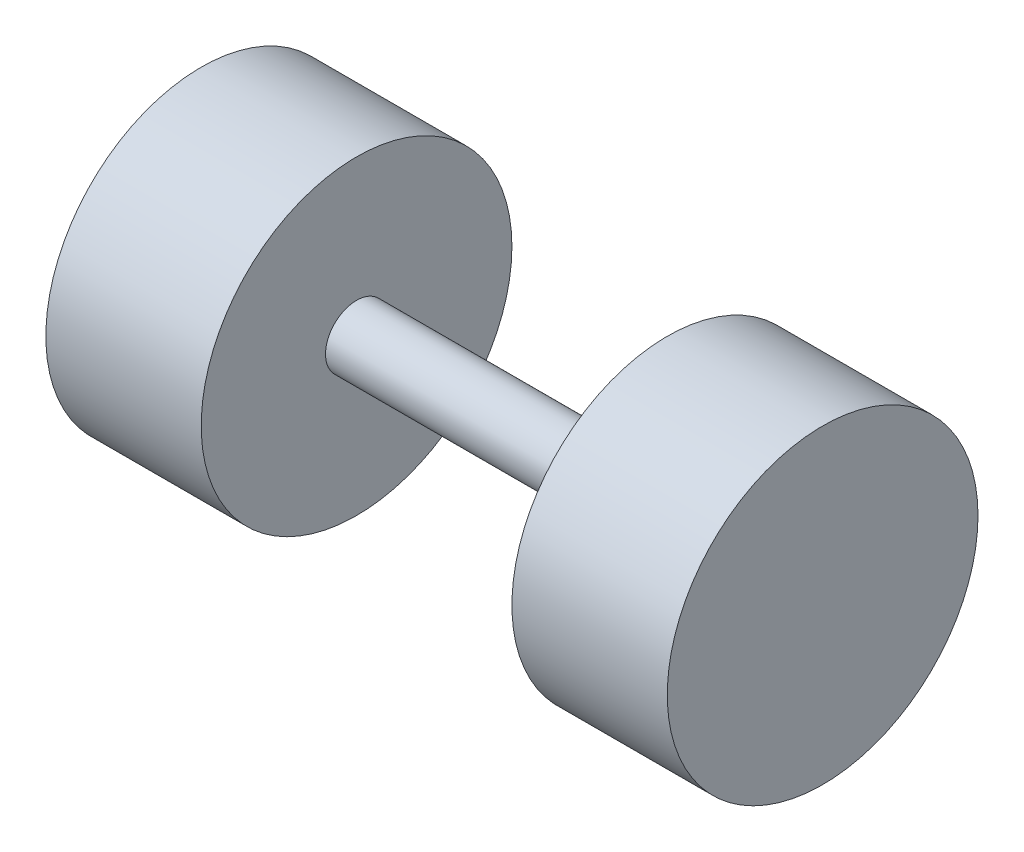
from build123d import *

# Parameters (mm, degrees)
SKETCH_1_W   = 500
SKETCH_1_H   = 100
SKETCH_1_H_2 = 500


with BuildPart() as part:
    # ｽｹｯﾁ1 → 回転1 (revolve)
    with BuildSketch(Plane.XY, mode=Mode.PRIVATE) as revolve_1_sk:
        with Locations((-250, -50)):
            Rectangle(SKETCH_1_W, SKETCH_1_H)
        with Locations((250, -250)):
            Rectangle(SKETCH_1_W, SKETCH_1_H_2)
    revolve(revolve_1_sk.sketch.rotate(Axis((0, 0, 0), (-1, 0, 0)), 270), axis=Axis((0, 0, 0), (-1, 0, 0)))

    # ﾐﾗｰ1: part across plane


with BuildPart() as part_1:
    add(part.part)
    add(part.part.mirror(Plane(origin=(-500, 0, 0), x_dir=(0, 0, 1), z_dir=(1, 0, 0))))


solid = part_1.part
